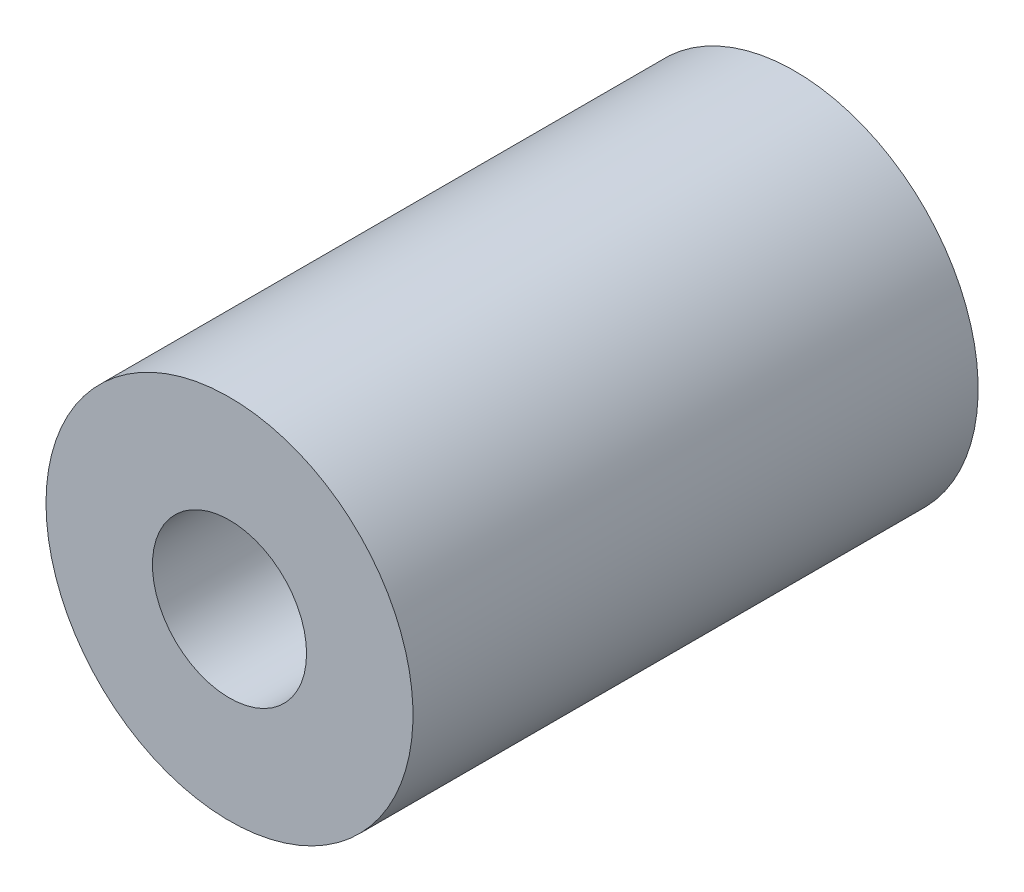
from build123d import *

# Parameters (mm, degrees)
SKETCH_1_R          = 5
EXTRUDE_1_DEPTH     = 15.4
SKETCH_2_R          = 2.1
CUT_EXTRUDE_1_DEPTH = 10


with BuildPart() as part:
    # ｽｹｯﾁ1 → ﾎﾞｽ - 押し出し1 (new body)
    with BuildSketch(Plane.XY):
        with Locations(Location((0, 0, 0), (0, 0, 180))):
            Circle(SKETCH_1_R)
    extrude(amount=EXTRUDE_1_DEPTH)

    # ｽｹｯﾁ2 → ｶｯﾄ - 押し出し1 (cut)
    with BuildSketch(Plane.XY.offset(15.4)):
        Circle(SKETCH_2_R)
    cut_extrude_1 = extrude(amount=-CUT_EXTRUDE_1_DEPTH, mode=Mode.SUBTRACT)

    # ﾐﾗｰ1: ｶｯﾄ - 押し出し1 across plane
    add(cut_extrude_1.mirror(Plane.XY.offset(7.7)), mode=Mode.SUBTRACT)


solid = part.part
